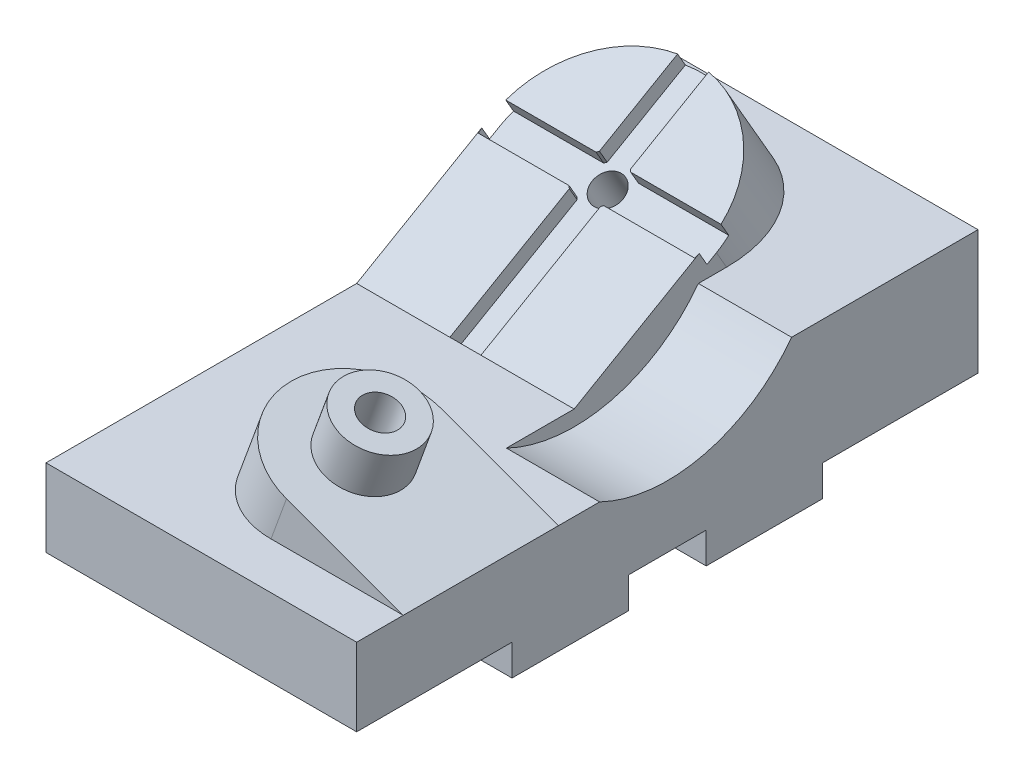
from build123d import *

# Parameters (mm, degrees)
SKETCH1_W            = 100
SKETCH1_H            = 200
BOSS_EXTRUDE1_DEPTH  = 25
BOSS_EXTRUDE3_REACH  = 224.221
SKETCH4_R            = 12.5
BOSS_EXTRUDE4_DEPTH  = 15
SKETCH5_R            = 6
CUT_EXTRUDE1_DEPTH   = 225.303099777
SKETCH6_W            = 100
SKETCH6_H            = 37.5
BOSS_EXTRUDE5_DEPTH  = 10
SKETCH7_W            = 100
SKETCH7_H            = 37.5
BOSS_EXTRUDE6_DEPTH  = 10
SKETCH8_W            = 100
SKETCH8_H            = 60
BOSS_EXTRUDE7_DEPTH  = 15
BOSS_EXTRUDE9_DEPTH  = 37
SKETCH12_R           = 7.5
CUT_EXTRUDE7_DEPTH   = 5
CUT_EXTRUDE8_DEPTH   = 5
CUT_EXTRUDE9_DEPTH   = 5
BOSS_EXTRUDE10_DEPTH = 30
CUT_EXTRUDE10_DEPTH  = 30
SKETCH18_R           = 5
CUT_EXTRUDE11_DEPTH  = 206.831491767


with BuildPart() as part:
    # Sketch1 → Boss-Extrude1 (new body)
    with BuildSketch(Plane(origin=(0, 0, 0), x_dir=(1, 0, 0), z_dir=(0, 1, 0))):
        with Locations((50, -100)):
            Rectangle(SKETCH1_W, SKETCH1_H)
    extrude(amount=BOSS_EXTRUDE1_DEPTH)

    # Boss-Extrude3: up to this face of the body (flat: up to its plane)
    boss_extrude3_end = Plane(part.part.faces().sort_by_distance((50, 0, 100))[0])
    # Sketch3 → Boss-Extrude3 (add, up to the picked face)
    with BuildSketch(Plane(origin=(19.732622965, 54.214936023, 0), x_dir=(0, 0, -1), z_dir=(0.34202014332566943, 0.9396926207859081, 0)), mode=Mode.PRIVATE) as boss_extrude3_sk1:
        with BuildLine():
            Line((-185, -85.418758495), (-135, -85.418758495))
            Line((-135, -85.418758495), (-135, -45.418758495))
            ThreePointArc((-135, -45.418758495), (-160, -20.418758495), (-185, -45.418758495))
            Line((-185, -45.418758495), (-185, -85.418758495))
        make_face()
    boss_extrude3_tool1 = split(extrude(boss_extrude3_sk1.sketch, amount=-BOSS_EXTRUDE3_REACH, mode=Mode.PRIVATE), bisect_by=boss_extrude3_end, keep=Keep.BOTH, mode=Mode.PRIVATE)
    add(boss_extrude3_tool1.solids().sort_by(Axis((71.735431, 35.287462, 160), (-0.34202014332566943, -0.9396926207859081, 0)))[0])

    # Sketch4 → Boss-Extrude4 (add)
    with BuildSketch(Plane(origin=(19.732622965, 54.214936023, 0), x_dir=(0.9396926207859082, -0.34202014332566943, 0), z_dir=(0.34202014332566943, 0.9396926207859082, 0))):
        with Locations(Location((45.418758495, -160, 0), (0, 0, 180))):
            Circle(SKETCH4_R)
    extrude(amount=BOSS_EXTRUDE4_DEPTH)

    # Sketch5 → Cut-Extrude1 (cut, through all)
    with BuildSketch(Plane(origin=(24.862925115, 68.310325335, 0), x_dir=(0.9396926207859082, -0.34202014332566943, 0), z_dir=(0.34202014332566943, 0.9396926207859082, 0))):
        with Locations(Location((45.418758495, -160, 0), (0, 0, 180))):
            Circle(SKETCH5_R)
    extrude(amount=-CUT_EXTRUDE1_DEPTH, mode=Mode.SUBTRACT)

    # Sketch6 → Boss-Extrude5 (add)
    with BuildSketch(Plane.XZ):
        with Locations((50, 131.25)):
            Rectangle(SKETCH6_W, SKETCH6_H)
    extrude(amount=BOSS_EXTRUDE5_DEPTH)

    # Sketch7 → Boss-Extrude6 (add)
    with BuildSketch(Plane.XZ):
        with Locations((50, 68.75)):
            Rectangle(SKETCH7_W, SKETCH7_H)
    extrude(amount=BOSS_EXTRUDE6_DEPTH)

    # Sketch8 → Boss-Extrude7 (add)
    with BuildSketch(Plane(origin=(0, 25, 0), x_dir=(1, 0, 0), z_dir=(0, 1, 0))):
        with Locations((50, -30)):
            Rectangle(SKETCH8_W, SKETCH8_H)
    extrude(amount=BOSS_EXTRUDE7_DEPTH)

    # Sketch10 → Boss-Extrude9 (add)
    with BuildSketch(Plane(origin=(0, 62.051270189, 35.825317547), x_dir=(1, 0, 0), z_dir=(0, 0.866025403784438, 0.500000000000001))):
        with BuildLine():
            Line((0, -74.102540378), (70, -74.102540378))
            Line((70, -74.102540378), (70, -24.102540378))
            ThreePointArc((70, -24.102540378), (35, 10.897459622), (0, -24.102540378))
            Line((0, -24.102540378), (0, -74.102540378))
        make_face()
    extrude(amount=-BOSS_EXTRUDE9_DEPTH)

    # Sketch12 → Cut-Extrude7 (cut)
    with BuildSketch(Plane(origin=(0, 62.051270189, 35.825317547), x_dir=(1, 0, 0), z_dir=(0, 0.8660254037844382, 0.500000000000001))):
        with Locations(Location((35, -24.102540378, 0), (0, 0, 270))):
            Circle(SKETCH12_R)
    extrude(amount=-CUT_EXTRUDE7_DEPTH, mode=Mode.SUBTRACT)

    # Sketch13 → Cut-Extrude8 (cut)
    with BuildSketch(Plane(origin=(0, 62.051270189, 35.825317547), x_dir=(1, 0, 0), z_dir=(0, 0.8660254037844382, 0.500000000000001))):
        with BuildLine():
            Line((35, -74.102540378), (40, -74.102540378))
            Line((40, -74.102540378), (40, -29.507888224))
            ThreePointArc((40, -29.507888224), (35, -31.465813111), (30, -29.507888224))
            Line((30, -29.507888224), (30, -74.102540378))
            Line((30, -74.102540378), (35, -74.102540378))
        make_face()
        with BuildLine():
            Line((40, -18.697192533), (40, 10.538475773))
            ThreePointArc((40, 10.538475773), (35, 10.897459622), (30, 10.538475773))
            Line((30, 10.538475773), (30, -18.697192533))
            ThreePointArc((30, -18.697192533), (35, -16.739267646), (40, -18.697192533))
        make_face()
    extrude(amount=-CUT_EXTRUDE8_DEPTH, mode=Mode.SUBTRACT)

    # Sketch14 → Cut-Extrude9 (cut)
    with BuildSketch(Plane(origin=(0, 62.051270189, 35.825317547), x_dir=(1, 0, 0), z_dir=(0, 0.8660254037844382, 0.500000000000001))):
        with BuildLine():
            Line((29.409830056, -19.102540378), (0.181014248, -19.102540378))
            ThreePointArc((0.181014248, -19.102540378), (-0.176153411, -24.102540378), (0.181014248, -29.102540378))
            Line((0.181014248, -29.102540378), (29.409830056, -29.102540378))
            ThreePointArc((29.409830056, -29.102540378), (27.5, -24.102540378), (29.409830056, -19.102540378))
        make_face()
        with BuildLine():
            Line((40.590169944, -19.102540378), (69.818985752, -19.102540378))
            ThreePointArc((69.818985752, -19.102540378), (70.176153411, -24.102540378), (69.818985752, -29.102540378))
            Line((69.818985752, -29.102540378), (40.590169944, -29.102540378))
            ThreePointArc((40.590169944, -29.102540378), (42.5, -24.102540378), (40.590169944, -19.102540378))
        make_face()
    extrude(amount=-CUT_EXTRUDE9_DEPTH, mode=Mode.SUBTRACT)

    # Sketch16 → Boss-Extrude10 (add)
    with BuildSketch(Plane(origin=(100, 0, 0), x_dir=(0, 0, -1), z_dir=(1, 0, 0))):
        with BuildLine():
            Line((-121.794494718, 25), (-200, 25))
            Line((-200, 25), (-200, 0))
            Line((-200, 0), (-150, 0))
            Line((-150, 0), (-150, -10))
            Line((-150, -10), (-112.5, -10))
            Line((-112.5, -10), (-112.5, 0))
            Line((-112.5, 0), (-87.5, 0))
            Line((-87.5, 0), (-87.5, -10))
            Line((-87.5, -10), (-50, -10))
            Line((-50, -10), (-50, 0))
            Line((-50, 0), (0, 0))
            Line((0, 0), (0, 40))
            Line((0, 40), (-60, 40))
            ThreePointArc((-60, 40), (-88.205505282, 21.411010565), (-121.794494718, 25))
        make_face()
    extrude(amount=-BOSS_EXTRUDE10_DEPTH)

    # Sketch17 → Cut-Extrude10 (cut)
    with BuildSketch(Plane(origin=(100, 0, 0), x_dir=(0, 0, -1), z_dir=(1, 0, 0))):
        with BuildLine():
            Line((-121.794494718, 25), (-78.205505282, 25))
            ThreePointArc((-78.205505282, 25), (-100, 20), (-121.794494718, 25))
        make_face()
    extrude(amount=-CUT_EXTRUDE10_DEPTH, mode=Mode.SUBTRACT)

    # Sketch18 → Cut-Extrude11 (cut, through all)
    with BuildSketch(Plane(origin=(0, 57.72114317, 33.325317547), x_dir=(1, 0, 0), z_dir=(0, 0.8660254037844382, 0.5000000000000011))):
        with Locations(Location((35, -24.102540378, 0), (0, 0, 270))):
            Circle(SKETCH18_R)
    extrude(amount=-CUT_EXTRUDE11_DEPTH, mode=Mode.SUBTRACT)


solid = part.part
